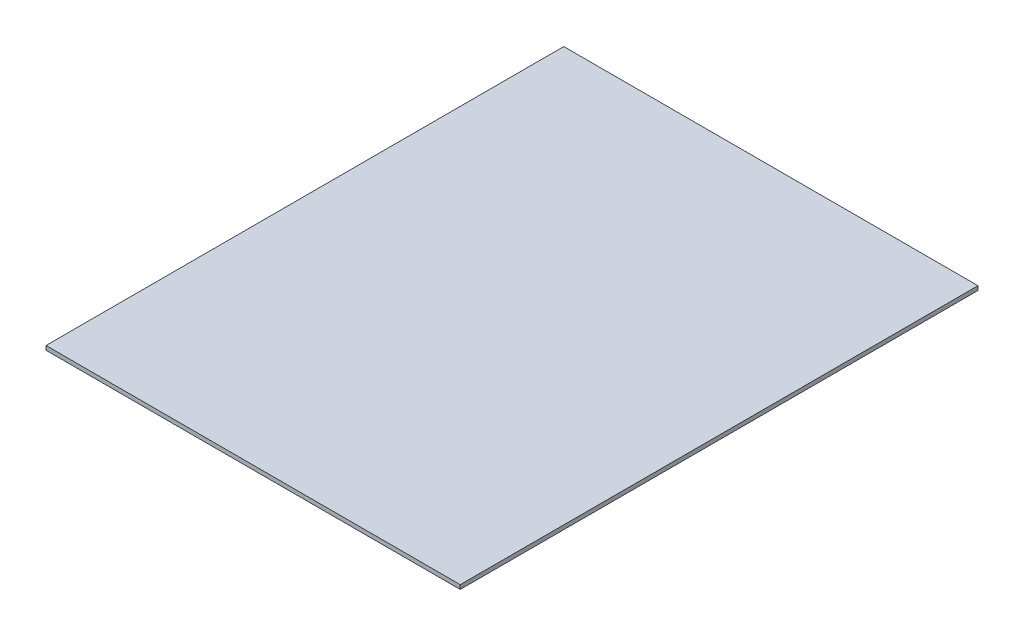
from build123d import *

# Parameters (mm, degrees)
OVEN_OMAKE_HAZNE_1_TEPSI_DUZLEMI_117_1_START = -60
SKETCH1_W                                    = 400
SKETCH1_H                                    = 4
OVEN_OMAKE_HAZNE_1_TEPSI_DUZLEMI_117_1_DEPTH = 500


with BuildPart() as part:
    # Sketch1 → OVEN_OMAKE_hazne_1_tepsi_duzlemi_117_1 (new body)
    with BuildSketch(Plane.XY.offset(OVEN_OMAKE_HAZNE_1_TEPSI_DUZLEMI_117_1_START)):
        with Locations((350, 1168)):
            Rectangle(SKETCH1_W, SKETCH1_H)
    extrude(amount=-OVEN_OMAKE_HAZNE_1_TEPSI_DUZLEMI_117_1_DEPTH)


solid = part.part
